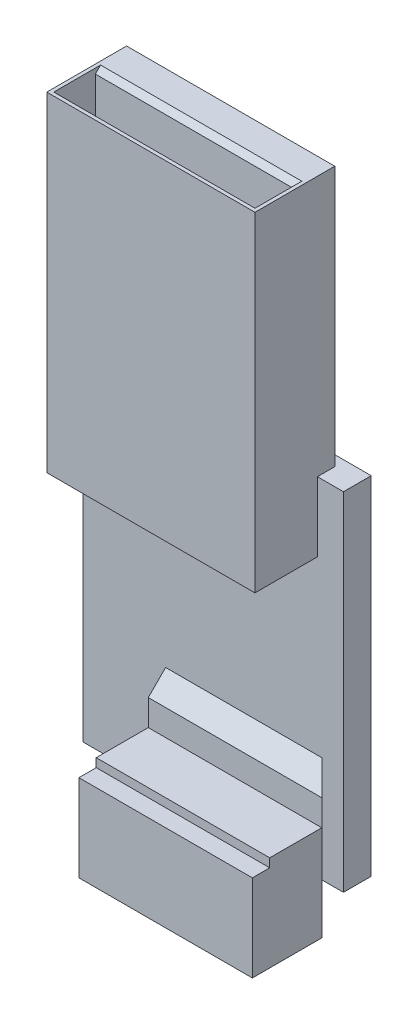
from build123d import *

# Parameters (mm, degrees)
BOSS_EXTRUDE1_DEPTH = 5500
BOSS_EXTRUDE2_DEPTH = 2500
SKETCH3_W           = 15000
SKETCH3_H           = 20000
BOSS_EXTRUDE3_DEPTH = 1600
SKETCH4_W           = 12000
SKETCH4_H           = 1000
BOSS_EXTRUDE4_DEPTH = 15000
SKETCH5_W           = 12000
SKETCH5_H           = 19000
BOSS_EXTRUDE5_DEPTH = 3600
SKETCH6_W           = 1000
SKETCH6_H           = 500
CUT_EXTRUDE1_DEPTH  = 27815.070180396
SKETCH7_W           = 11600
SKETCH7_H           = 2400
CUT_EXTRUDE2_DEPTH  = 9500
DRAFT1_ANGLE        = 45
CHAMFER1_SIZE       = 300


with BuildPart() as part:
    # Sketch1 → Boss-Extrude1 (new body)
    with BuildSketch(Plane.XZ.offset(11900)):
        Polygon((6250, 1600), (7250, 2600), (7250, 6600), (-2750, 6600), (-2750, 1600), align=None)
    extrude(amount=-BOSS_EXTRUDE1_DEPTH)

    # Sketch2 → Boss-Extrude2 (add)
    with BuildSketch(Plane(origin=(0, -6400, 0), x_dir=(-1, 0, 0), z_dir=(0, 1, 0))):
        Polygon((2750, 2600), (2750, 1600), (-6250, 1600), (-7250, 2600), align=None)
    extrude(amount=BOSS_EXTRUDE2_DEPTH)

    # Sketch3 → Boss-Extrude3 (add)
    with BuildSketch(Plane(origin=(0, 0, 1600), x_dir=(-1, 0, 0), z_dir=(0, 0, -1))):
        Rectangle(SKETCH3_W, SKETCH3_H)
    extrude(amount=BOSS_EXTRUDE3_DEPTH)

    # Sketch4 → Boss-Extrude4 (add)
    with BuildSketch(Plane(origin=(0, 10000, 0), x_dir=(-1, 0, 0), z_dir=(0, 1, 0))):
        with Locations((0, 1100)):
            Rectangle(SKETCH4_W, SKETCH4_H)
    extrude(amount=BOSS_EXTRUDE4_DEPTH)

    # Sketch5 → Boss-Extrude5 (add)
    with BuildSketch(Plane.XY.offset(1600)):
        with Locations((0, 15500)):
            Rectangle(SKETCH5_W, SKETCH5_H)
    extrude(amount=BOSS_EXTRUDE5_DEPTH)

    # Sketch6 → Cut-Extrude1 (cut, through all)
    with BuildSketch(Plane.ZY.offset(2750)):
        with Locations((6100, -6650)):
            Rectangle(SKETCH6_W, SKETCH6_H)
    extrude(amount=-CUT_EXTRUDE1_DEPTH, mode=Mode.SUBTRACT)

    # Sketch7 → Cut-Extrude2 (cut)
    with BuildSketch(Plane(origin=(0, 25000, 0), x_dir=(-1, 0, 0), z_dir=(0, 1, 0))):
        with Locations((0, 3800)):
            Rectangle(SKETCH7_W, SKETCH7_H)
    extrude(amount=-CUT_EXTRUDE2_DEPTH, mode=Mode.SUBTRACT)

    # Draft1
    draft1_faces = [part.faces().sort_by_distance(p)[0] for p in [
        (2004.385964912, -3900, 2108.771929825),
    ]]
    draft(draft1_faces, Plane.XY.offset(1600), DRAFT1_ANGLE)

    # Chamfer1
    chamfer1_edges = [part.edges().sort_by_distance(p)[0] for p in [
        (0, 25000, 2600),
    ]]
    chamfer(chamfer1_edges, length=CHAMFER1_SIZE)


solid = part.part
